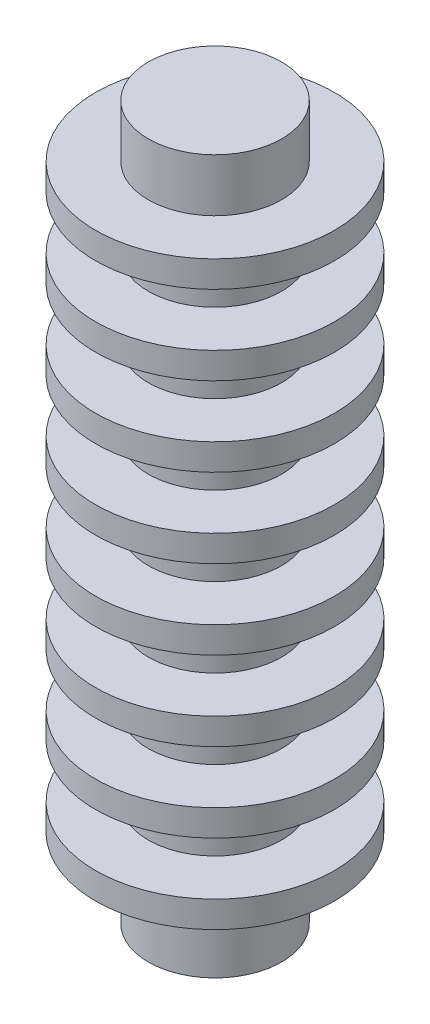
from build123d import *


with BuildPart() as part:
    # Sketch1 → Revolve1 (revolve)
    with BuildSketch(Plane.XY, mode=Mode.PRIVATE) as revolve1_sk:
        Polygon((5.05, 24), (5.05, 23), (9.05, 23), (9.05, 21), (5.05, 21), (5.05, 18), (5.05, 17), (9.05, 17), (9.05, 15), (5.05, 15), (5.05, 12), (5.05, 11), (9.05, 11), (9.05, 9), (5.05, 9), (5.05, 6), (5.05, 5), (9.05, 5), (9.05, 3), (5.05, 3), (5.05, 0), (5.05, -1), (9.05, -1), (9.05, -3), (5.05, -3), (5.05, -6), (5.05, -7), (9.05, -7), (9.05, -9), (5.05, -9), (5.05, -12), (5.05, -13), (9.05, -13), (9.05, -15), (5.05, -15), (5.05, -18), (5.05, -19), (9.05, -19), (9.05, -21), (5.05, -21), (5.05, -24), (5.05, -27), (0, -27), (0, 27), (5.05, 27), align=None)
    revolve(revolve1_sk.sketch.rotate(Axis((0, 27, 0), (0, -1, 0)), 180), axis=Axis((0, 27, 0), (0, -1, 0)))


solid = part.part
